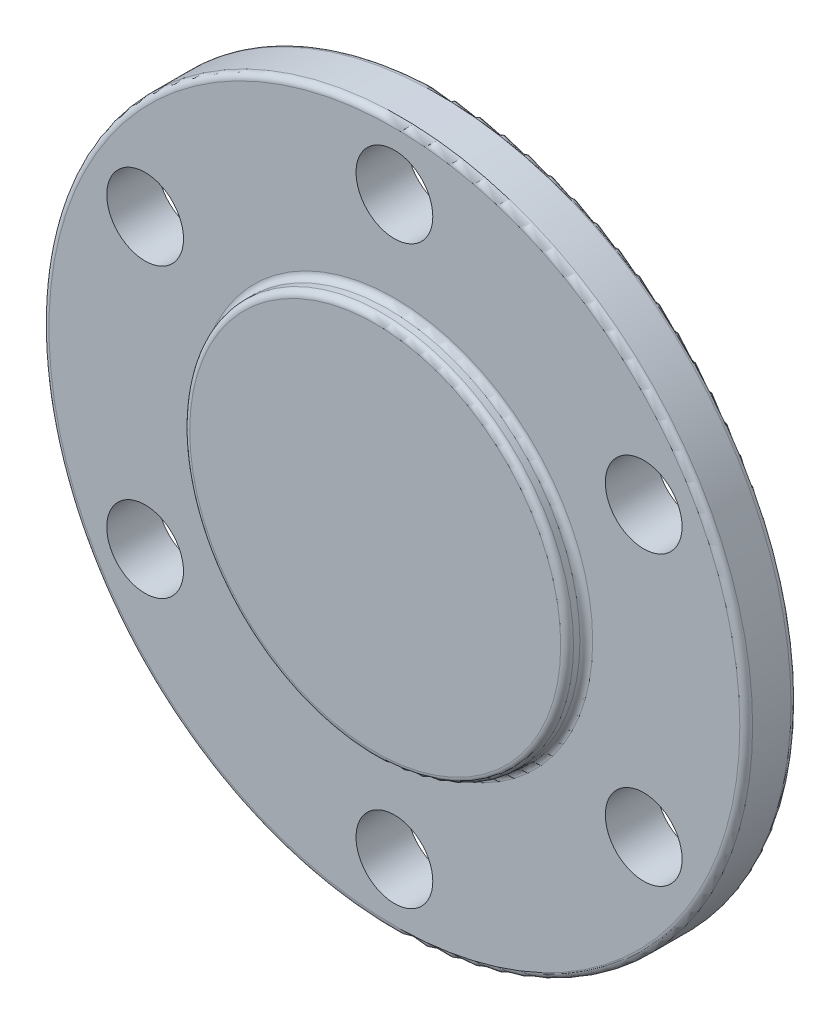
from build123d import *

# Parameters (mm, degrees)
SKETCH1_R           = 27.5
SKETCH1_R_2         = 3
BOSS_EXTRUDE1_DEPTH = 2
SKETCH2_R           = 15
BOSS_EXTRUDE2_DEPTH = 1.5
SKETCH3_R           = 10
BOSS_EXTRUDE3_DEPTH = 3
FILLET1_R           = 0.5


with BuildPart() as part:
    # Sketch1 → Boss-Extrude1 (new, symmetric)
    with BuildSketch(Plane.XY):
        Circle(SKETCH1_R)
        with Locations((0, 22.5)):
            Circle(SKETCH1_R_2, mode=Mode.SUBTRACT)
        with Locations((19.485571585, 11.25)):
            Circle(SKETCH1_R_2, mode=Mode.SUBTRACT)
        with Locations((19.485571585, -11.25)):
            Circle(SKETCH1_R_2, mode=Mode.SUBTRACT)
        with Locations((0, -22.5)):
            Circle(SKETCH1_R_2, mode=Mode.SUBTRACT)
        with Locations((-19.485571585, -11.25)):
            Circle(SKETCH1_R_2, mode=Mode.SUBTRACT)
        with Locations((-19.485571585, 11.25)):
            Circle(SKETCH1_R_2, mode=Mode.SUBTRACT)
    extrude(amount=BOSS_EXTRUDE1_DEPTH, both=True)

    # Sketch2 → Boss-Extrude2 (add)
    with BuildSketch(Plane.XY.offset(2)):
        Circle(SKETCH2_R)
    extrude(amount=BOSS_EXTRUDE2_DEPTH)

    # Sketch3 → Boss-Extrude3 (add)
    with BuildSketch(Plane(origin=(0, 0, -2), x_dir=(-1, 0, 0), z_dir=(0, 0, -1))):
        with Locations(Location((0, 0, 0), (0, 0, 180))):
            Circle(SKETCH3_R)
    extrude(amount=BOSS_EXTRUDE3_DEPTH)

    # Fillet1
    fillet1_edges = [part.edges().sort_by_distance(p)[0] for p in [
        (-27.5, 0, -2),
        (-15, 0, 2),
        (-15, 0, 3.5),
        (-10, 0, -2),
        (-10, 0, -5),
        (-27.5, 0, 2),
    ]]
    fillet(fillet1_edges, radius=FILLET1_R)


solid = part.part
